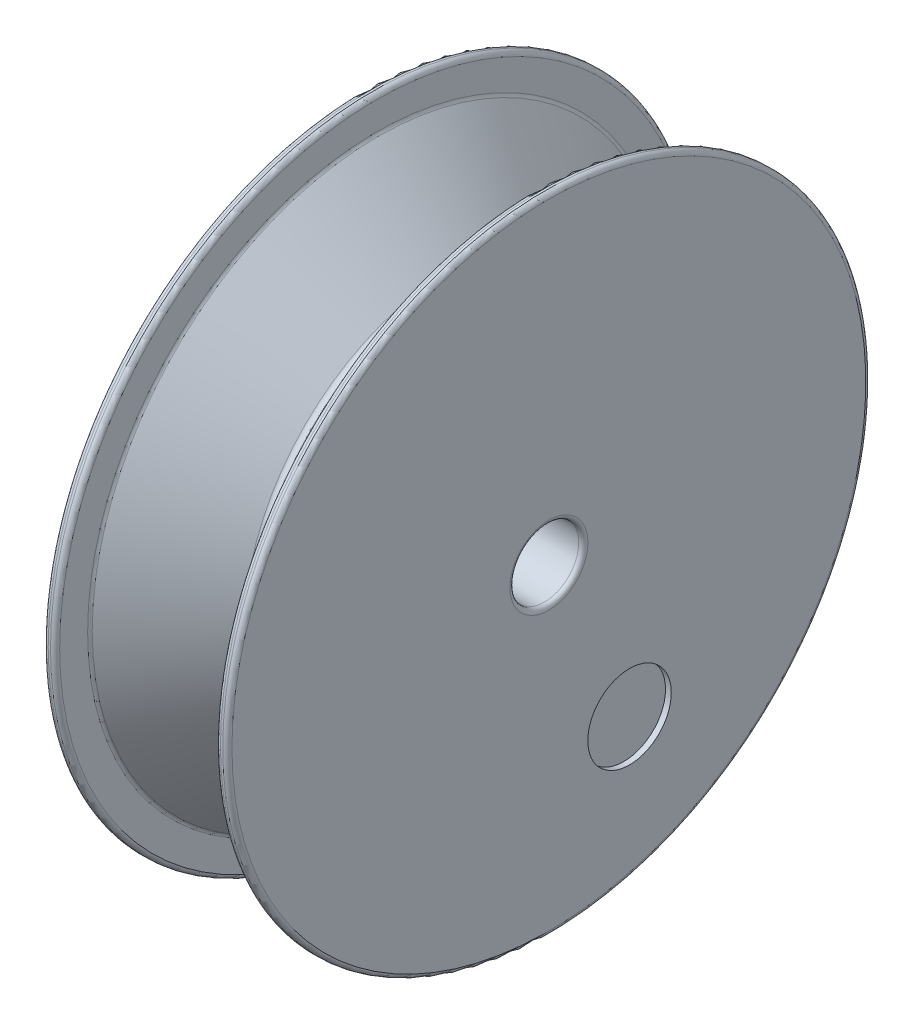
from build123d import *

# Parameters (mm, degrees)
CONG_1_R                = 0.2
ESQUISSE2_R             = 1.817280817
ENL_V_MAT_EXTRU_1_DEPTH = 0.25


with BuildPart() as part:
    # Esquisse1 → Révolution2 (revolve)
    with BuildSketch(Plane.XY, mode=Mode.PRIVATE) as r_volution2_sk:
        Polygon((-3.5, 12.5), (0, 9), (3.5, 12.5), (3.5, 14), (4, 14), (4, 1.5), (-4, 1.5), (-4, 14), (-3.5, 14), align=None)
    revolve(r_volution2_sk.sketch.rotate(Axis((0, 0, 0), (1, 0, 0)), 90), axis=Axis((0, 0, 0), (1, 0, 0)))

    # Congé1
    cong_1_edges = [part.edges().sort_by_distance(p)[0] for p in [
        (-3.5, 0, -12.5),
        (0, 0, -9),
        (3.5, 0, -12.5),
        (3.5, 0, -14),
        (4, 0, -14),
        (4, 0, -1.5),
        (-4, 0, -1.5),
        (-4, 0, -14),
        (-3.5, 0, -14),
    ]]
    fillet(cong_1_edges, radius=CONG_1_R)

    # Esquisse2 → Enlèv. mat.-Extru.1 (cut)
    with BuildSketch(Plane(origin=(4, 0, 0), x_dir=(0, 0, -1), z_dir=(1, 0, 0))):
        with Locations((3.511925598, -7.472568147)):
            Circle(ESQUISSE2_R)
    extrude(amount=-ENL_V_MAT_EXTRU_1_DEPTH, mode=Mode.SUBTRACT)


solid = part.part
